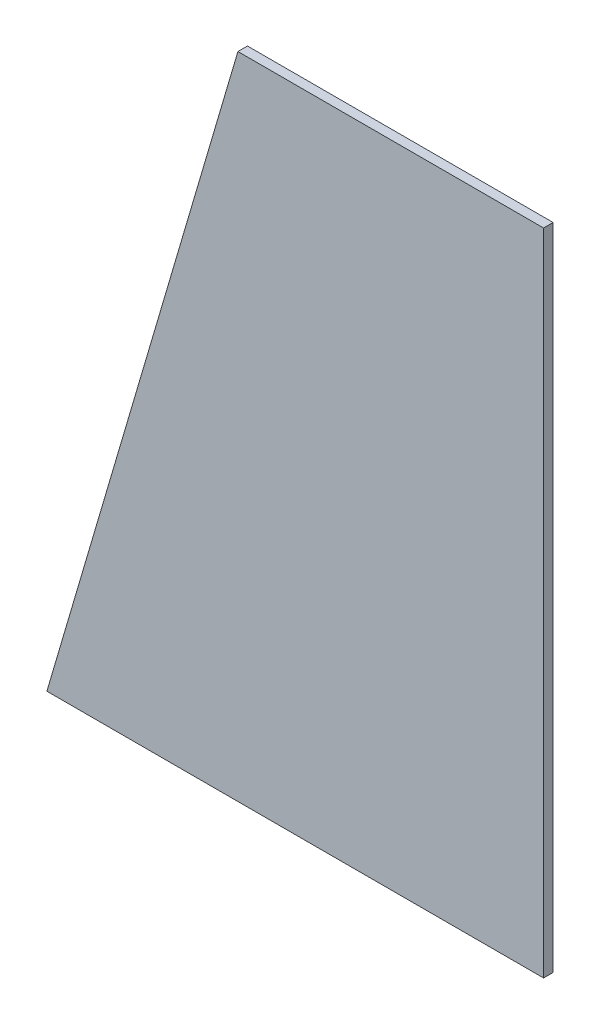
from build123d import *

# Parameters (mm, degrees)
BOSS_EXTRUDE1_DEPTH = 3.175


with BuildPart() as part:
    # Sketch1 → Boss-Extrude1 (new body)
    with BuildSketch(Plane.XY):
        Polygon((-101.6, 107.95), (0, 107.95), (0, -107.95), (-165.1, -107.95), align=None)
    extrude(amount=-BOSS_EXTRUDE1_DEPTH)


solid = part.part
